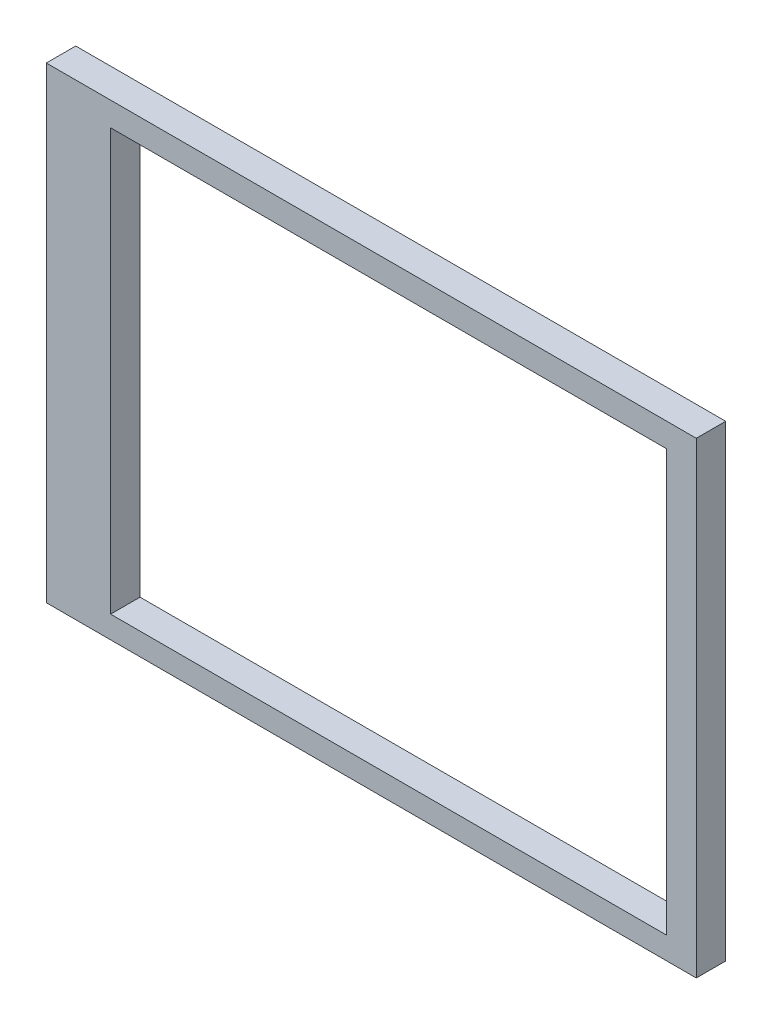
from build123d import *

# Parameters (mm, degrees)
SKETCH1_W           = 61.85
SKETCH1_H           = 44.48
SKETCH1_W_2         = 52.88
SKETCH1_H_2         = 40.08
BOSS_EXTRUDE1_DEPTH = 2.8


with BuildPart() as part:
    # Sketch1 → Boss-Extrude1 (new body)
    with BuildSketch(Plane.XY):
        with Locations((-1.635, 0.08)):
            Rectangle(SKETCH1_W, SKETCH1_H)
        Rectangle(SKETCH1_W_2, SKETCH1_H_2, mode=Mode.SUBTRACT)
    extrude(amount=BOSS_EXTRUDE1_DEPTH)


solid = part.part
